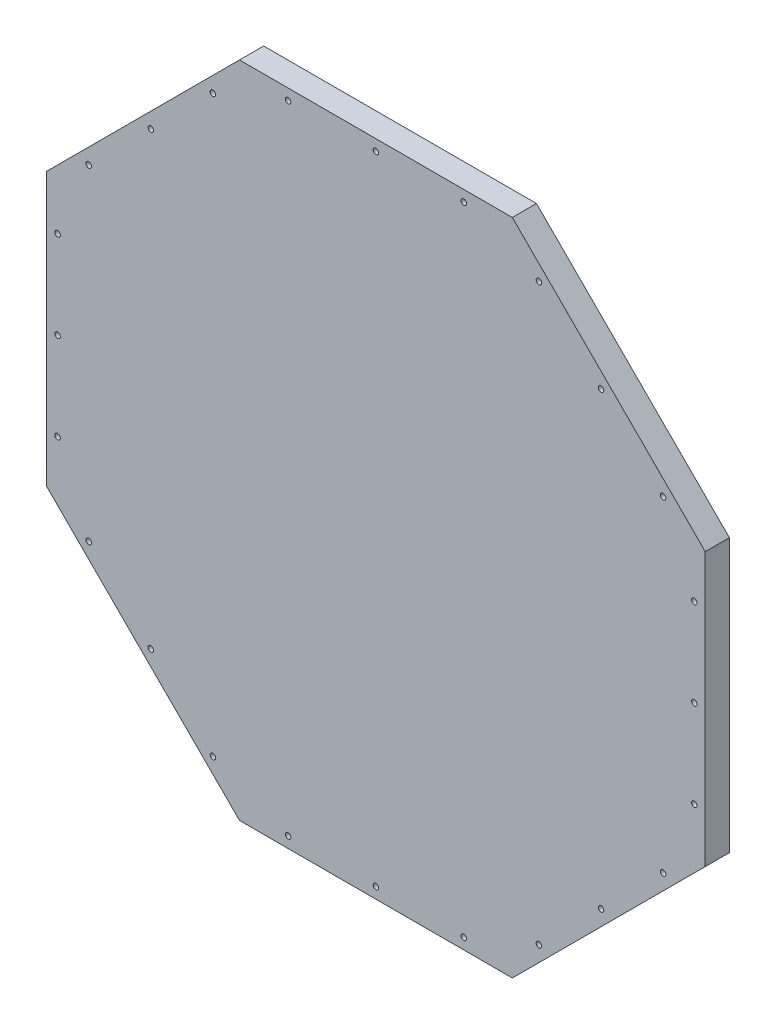
from build123d import *

# Parameters (mm, degrees)
SKETCH_1_R      = 2.5
EXTRUDE_1_DEPTH = 22


with BuildPart() as part:
    # 스케치1 → 보스-돌출1 (new body)
    with BuildSketch(Plane.XY):
        Polygon((124.264068712, 300), (-124.264068712, 300), (-300, 124.264068712), (-300, -124.264068712), (-124.264068712, -300), (124.264068712, -300), (300, -124.264068712), (300, 124.264068712), align=None)
        with Locations((0, 290)):
            Circle(SKETCH_1_R, mode=Mode.SUBTRACT)
        with Locations((80, 290)):
            Circle(SKETCH_1_R, mode=Mode.SUBTRACT)
        with Locations((-80, 290)):
            Circle(SKETCH_1_R, mode=Mode.SUBTRACT)
        with Locations((148.492424049, 261.629509039)):
            Circle(SKETCH_1_R, mode=Mode.SUBTRACT)
        with Locations((205.060966544, 205.060966544)):
            Circle(SKETCH_1_R, mode=Mode.SUBTRACT)
        with Locations((261.629509039, 148.492424049)):
            Circle(SKETCH_1_R, mode=Mode.SUBTRACT)
        with Locations((290, 80)):
            Circle(SKETCH_1_R, mode=Mode.SUBTRACT)
        with Locations((290, 0)):
            Circle(SKETCH_1_R, mode=Mode.SUBTRACT)
        with Locations((290, -80)):
            Circle(SKETCH_1_R, mode=Mode.SUBTRACT)
        with Locations((261.629509039, -148.492424049)):
            Circle(SKETCH_1_R, mode=Mode.SUBTRACT)
        with Locations((205.060966544, -205.060966544)):
            Circle(SKETCH_1_R, mode=Mode.SUBTRACT)
        with Locations((148.492424049, -261.629509039)):
            Circle(SKETCH_1_R, mode=Mode.SUBTRACT)
        with Locations((80, -290)):
            Circle(SKETCH_1_R, mode=Mode.SUBTRACT)
        with Locations((0, -290)):
            Circle(SKETCH_1_R, mode=Mode.SUBTRACT)
        with Locations((-80, -290)):
            Circle(SKETCH_1_R, mode=Mode.SUBTRACT)
        with Locations((-148.492424049, -261.629509039)):
            Circle(SKETCH_1_R, mode=Mode.SUBTRACT)
        with Locations((-205.060966544, -205.060966544)):
            Circle(SKETCH_1_R, mode=Mode.SUBTRACT)
        with Locations((-261.629509039, -148.492424049)):
            Circle(SKETCH_1_R, mode=Mode.SUBTRACT)
        with Locations((-290, -80)):
            Circle(SKETCH_1_R, mode=Mode.SUBTRACT)
        with Locations((-290, 0)):
            Circle(SKETCH_1_R, mode=Mode.SUBTRACT)
        with Locations((-290, 80)):
            Circle(SKETCH_1_R, mode=Mode.SUBTRACT)
        with Locations((-261.629509039, 148.492424049)):
            Circle(SKETCH_1_R, mode=Mode.SUBTRACT)
        with Locations((-205.060966544, 205.060966544)):
            Circle(SKETCH_1_R, mode=Mode.SUBTRACT)
        with Locations((-148.492424049, 261.629509039)):
            Circle(SKETCH_1_R, mode=Mode.SUBTRACT)
    extrude(amount=EXTRUDE_1_DEPTH)


solid = part.part
